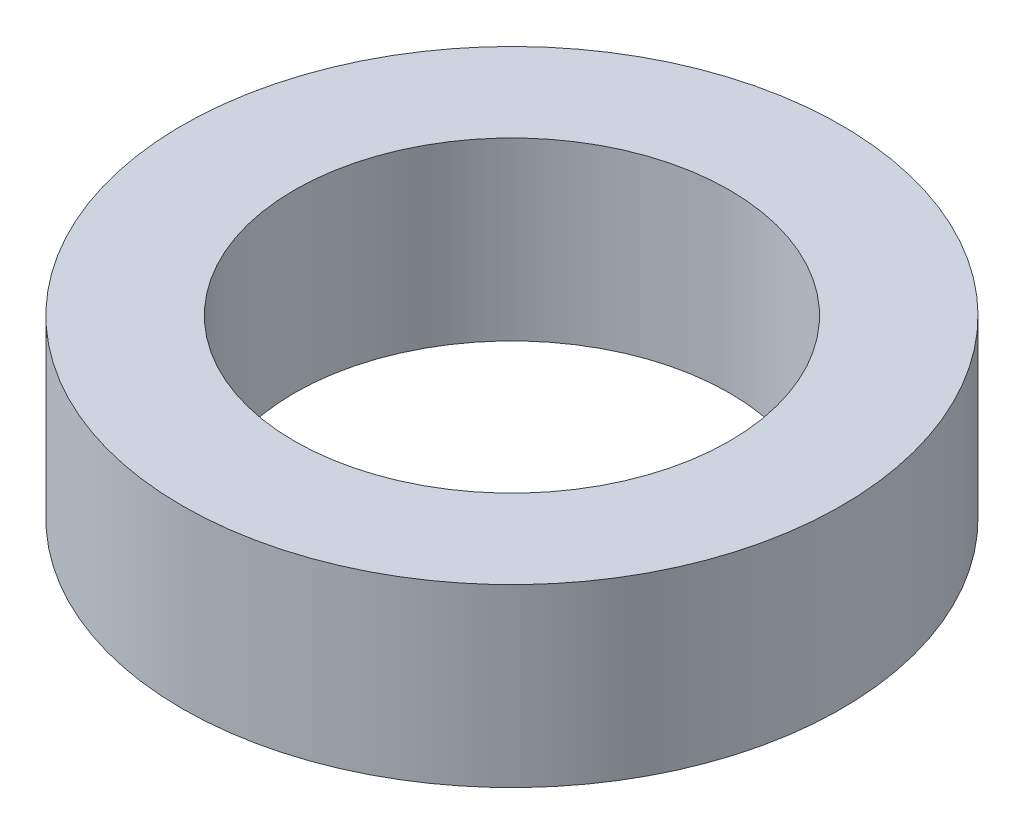
from build123d import *

# Parameters (mm, degrees)
SKETCH1_R           = 7.5
SKETCH1_R_2         = 4.95
BOSS_EXTRUDE1_DEPTH = 4


with BuildPart() as part:
    # Sketch1 → Boss-Extrude1 (new body)
    with BuildSketch(Plane(origin=(0, 0, 0), x_dir=(1, 0, 0), z_dir=(0, 1, 0))):
        with Locations(Location((0, 0, 0), (0, 0, 270))):
            Circle(SKETCH1_R)
        with Locations(Location((0, 0, 0), (0, 0, 270))):
            Circle(SKETCH1_R_2, mode=Mode.SUBTRACT)
    extrude(amount=BOSS_EXTRUDE1_DEPTH)


solid = part.part
